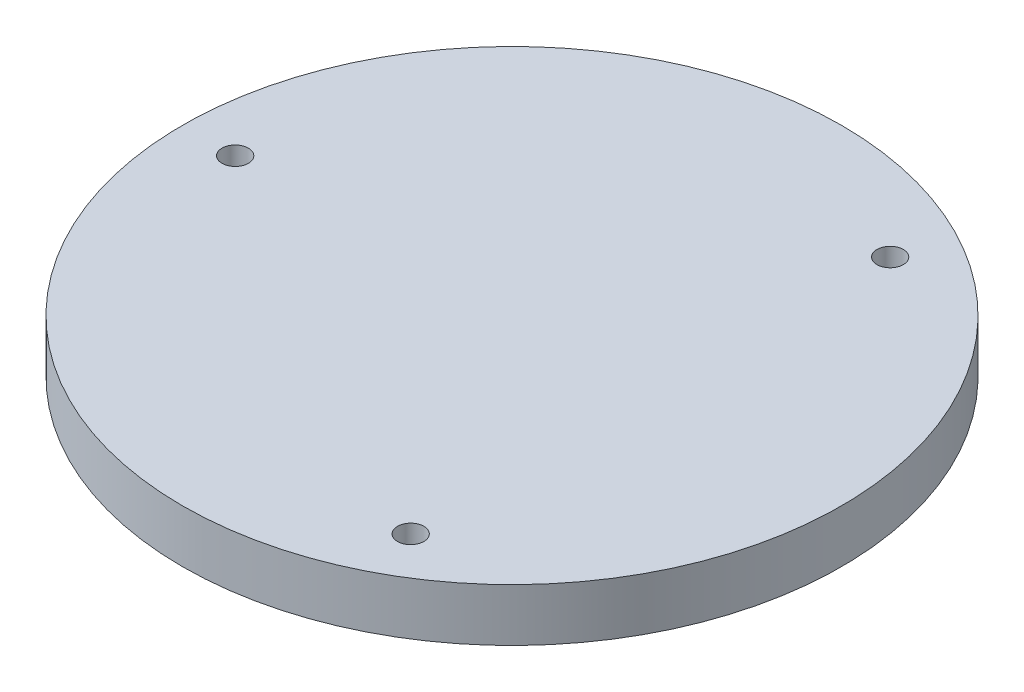
from build123d import *

# Parameters (mm, degrees)
SKETCH1_R                                           = 125
PLATE_DEPTH                                         = 20
CBORE_FOR_M5_HEX_SOCKET_HEAD_CAP_SCREW1_D           = 5.3
CBORE_FOR_M5_HEX_SOCKET_HEAD_CAP_SCREW1_CBORE_D     = 10
CBORE_FOR_M5_HEX_SOCKET_HEAD_CAP_SCREW1_CBORE_DEPTH = 15.4
CIRPATTERN1_COUNT                                   = 3


with BuildPart() as part:
    # Sketch1 → Plate (new body)
    with BuildSketch(Plane(origin=(0, 0, 0), x_dir=(1, 0, 0), z_dir=(0, 1, 0))):
        with Locations(Location((0, 0, 0), (0, 0, 270))):
            Circle(SKETCH1_R)
    extrude(amount=PLATE_DEPTH)

    # CBORE for M5 Hex Socket Head Cap Screw1 (through all)
    with Locations(Plane(origin=(0, 20, 0), x_dir=(1, 0, 0), z_dir=(0, 1, 0))):
        with Locations((-105, 0)):
            cbore_for_m5_hex_socket_head_cap_screw1 = CounterBoreHole(CBORE_FOR_M5_HEX_SOCKET_HEAD_CAP_SCREW1_D / 2, CBORE_FOR_M5_HEX_SOCKET_HEAD_CAP_SCREW1_CBORE_D / 2, CBORE_FOR_M5_HEX_SOCKET_HEAD_CAP_SCREW1_CBORE_DEPTH)

    # CirPattern1: CBORE for M5 Hex Socket Head Cap Screw1 ×3 about axis
    cirpattern1_axis = Axis((0, 0, 0), (0, 1, 0))
    for i in range(1, CIRPATTERN1_COUNT):
        add(cbore_for_m5_hex_socket_head_cap_screw1.rotate(cirpattern1_axis, i * 360 / CIRPATTERN1_COUNT), mode=Mode.SUBTRACT)


solid = part.part
